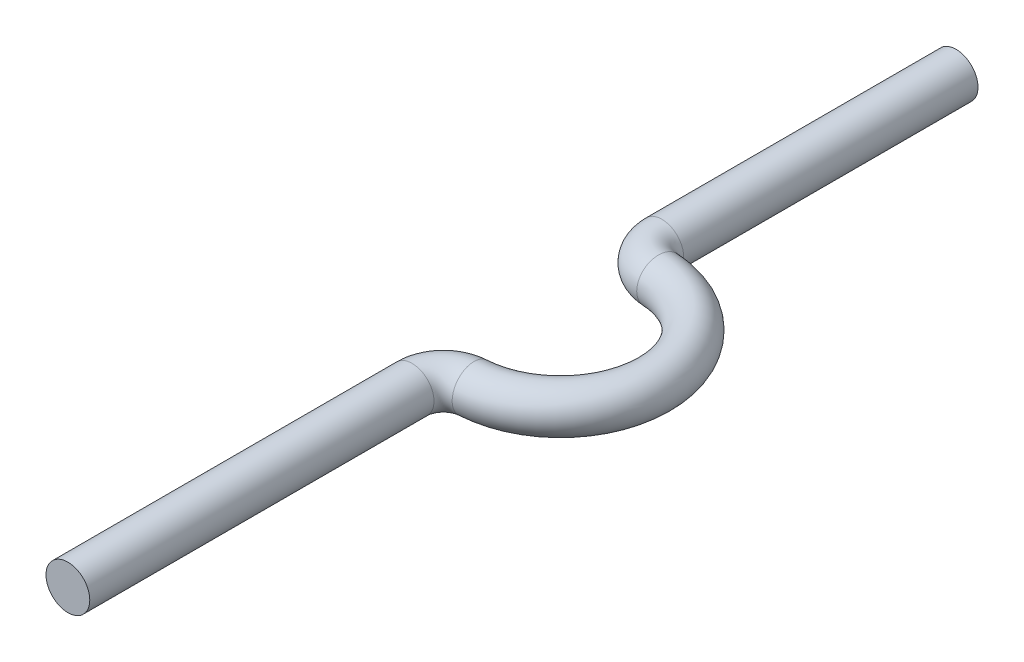
from build123d import *

# Parameters (mm, degrees)
CROQUIS2_R = 3.5


with BuildPart() as part:
    # Barrer2: sweep along a path in Croquis1
    with BuildLine(Plane(origin=(0, 0, 0), x_dir=(1, 0, 0), z_dir=(0, 1, 0))) as barrer2_path:
        Line((0, 0), (0, 55.031280577))
        ThreePointArc((0, 55.031280577), (1.355655066, 58.454546562), (4.6875, 60.021505397))
        ThreePointArc((4.6875, 60.021505397), (18.75, 74.992179856), (4.6875, 89.962854314))
        ThreePointArc((4.6875, 89.962854314), (1.355655066, 91.52981315), (0, 94.953079134))
        Line((0, 94.953079134), (0, 142))
    # Croquis2 → Barrer2 (sweep)
    with BuildSketch(Plane.XY):
        Circle(CROQUIS2_R)
    sweep(path=barrer2_path.line)


solid = part.part
